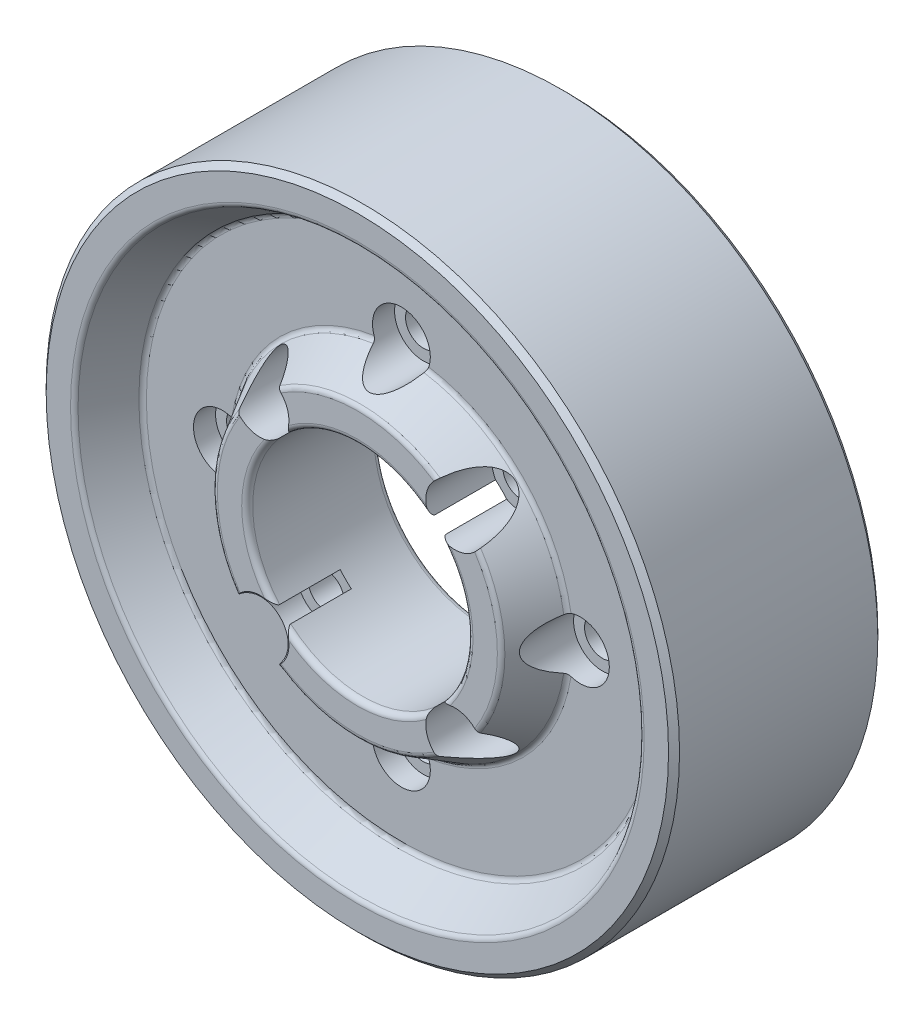
from build123d import *

# Parameters (mm, degrees)
CHAMFER1_SIZE      = 1
FILLET1_R          = 1
SKETCH2_R          = 3.25
CUT_EXTRUDE1_DEPTH = 90.758007999
SKETCH3_R          = 5.25
SKETCH3_R_2        = 3.25
CUT_EXTRUDE2_DEPTH = 12


with BuildPart() as part:
    # Sketch1 → Revolve1 (revolve)
    with BuildSketch(Plane(origin=(0, 0, 0), x_dir=(0, 0, -1), z_dir=(1, 0, 0)), mode=Mode.PRIVATE) as revolve1_sk:
        Polygon((-19, 20), (5, 20), (5, 37.5), (11, 37.5), (11, 46.881197846), (19, 51.5), (19, 57.5), (-19, 57.5), (-19, 51.5), (-11, 46.881197846), (-11, 30.618802154), (-19, 26), align=None)
    revolve(revolve1_sk.sketch.rotate(Axis((0, 0, 32.8), (0, 0, -1)), 90), axis=Axis((0, 0, 32.8), (0, 0, -1)))

    # Chamfer1
    chamfer1_edges = [part.edges().sort_by_distance(p)[0] for p in [
        (-57.5, 0, 19),
        (-57.5, 0, -19),
    ]]
    chamfer(chamfer1_edges, length=CHAMFER1_SIZE)

    # Fillet1
    fillet1_edges = [part.edges().sort_by_distance(p)[0] for p in [
        (-51.5, 0, -19),
        (-46.881197846, 0, -11),
        (-37.5, 0, -11),
        (-37.5, 0, -5),
        (-20, 0, -5),
        (-20, 0, 19),
        (-26, 0, 19),
        (-30.618802154, 0, 11),
        (-46.881197846, 0, 11),
        (-51.5, 0, 19),
    ]]
    fillet(fillet1_edges, radius=FILLET1_R)

    # Sketch2 → Cut-Extrude1 (cut, through all)
    with BuildSketch(Plane.XY.offset(19)):
        with Locations((0, 32.5)):
            Circle(SKETCH2_R)
        with Locations((32.5, 0)):
            Circle(SKETCH2_R)
        with Locations((17.67766953, 17.67766953)):
            Circle(SKETCH2_R)
        with Locations((17.67766953, -17.67766953)):
            Circle(SKETCH2_R)
        with Locations((0, -32.5)):
            Circle(SKETCH2_R)
        with Locations((-17.67766953, -17.67766953)):
            Circle(SKETCH2_R)
        with Locations((-32.5, 0)):
            Circle(SKETCH2_R)
        with Locations((-17.67766953, 17.67766953)):
            Circle(SKETCH2_R)
    extrude(amount=-CUT_EXTRUDE1_DEPTH, mode=Mode.SUBTRACT)

    # Sketch3 → Cut-Extrude2 (cut)
    # profile 1 of 8: a face of its own
    with BuildSketch(Plane.XY.offset(19)):
        with Locations((0, -32.5)):
            Circle(SKETCH3_R)
        with Locations((0, -32.5)):
            Circle(SKETCH3_R_2, mode=Mode.SUBTRACT)
    # profile 2 of 8: a face of its own
    with BuildSketch(Plane.XY.offset(19)):
        with Locations((17.67766953, -17.67766953)):
            Circle(SKETCH3_R)
        with Locations((17.67766953, -17.67766953)):
            Circle(SKETCH3_R_2, mode=Mode.SUBTRACT)
    # profile 3 of 8: a face of its own
    with BuildSketch(Plane.XY.offset(19)):
        with Locations((17.67766953, 17.67766953)):
            Circle(SKETCH3_R)
        with Locations((17.67766953, 17.67766953)):
            Circle(SKETCH3_R_2, mode=Mode.SUBTRACT)
    # profile 4 of 8: a face of its own
    with BuildSketch(Plane.XY.offset(19)):
        with Locations((32.5, 0)):
            Circle(SKETCH3_R)
        with Locations((32.5, 0)):
            Circle(SKETCH3_R_2, mode=Mode.SUBTRACT)
    # profile 5 of 8: a face of its own
    with BuildSketch(Plane.XY.offset(19)):
        with Locations((0, 32.5)):
            Circle(SKETCH3_R)
        with Locations((0, 32.5)):
            Circle(SKETCH3_R_2, mode=Mode.SUBTRACT)
    # profile 6 of 8: a face of its own
    with BuildSketch(Plane.XY.offset(19)):
        with Locations((-17.67766953, 17.67766953)):
            Circle(SKETCH3_R)
        with Locations((-17.67766953, 17.67766953)):
            Circle(SKETCH3_R_2, mode=Mode.SUBTRACT)
    # profile 7 of 8: a face of its own
    with BuildSketch(Plane.XY.offset(19)):
        with Locations((-32.5, 0)):
            Circle(SKETCH3_R)
        with Locations((-32.5, 0)):
            Circle(SKETCH3_R_2, mode=Mode.SUBTRACT)
    # profile 8 of 8: a face of its own
    with BuildSketch(Plane.XY.offset(19)):
        with Locations((-17.67766953, -17.67766953)):
            Circle(SKETCH3_R)
        with Locations((-17.67766953, -17.67766953)):
            Circle(SKETCH3_R_2, mode=Mode.SUBTRACT)
    extrude(amount=-CUT_EXTRUDE2_DEPTH, mode=Mode.SUBTRACT)


solid = part.part
